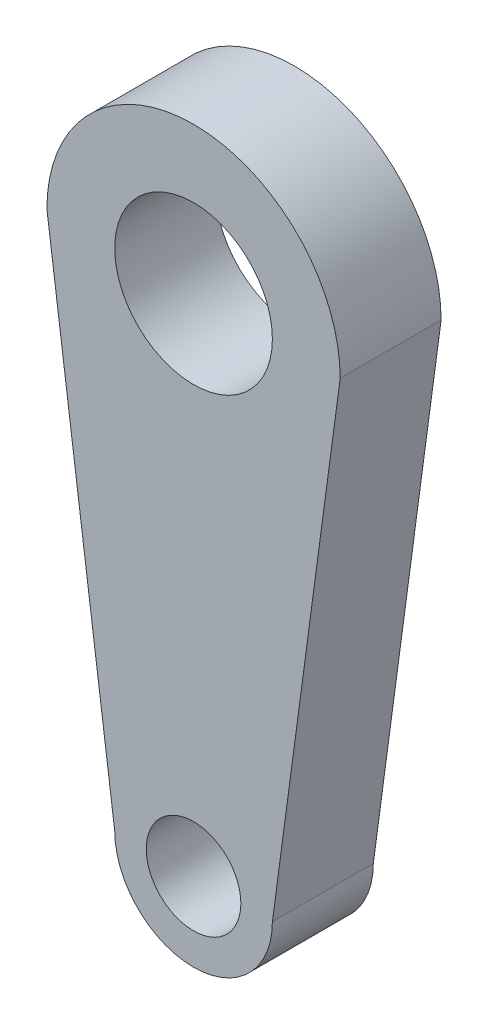
from build123d import *

# Parameters (mm, degrees)
CROQUIS1_R              = 2.5
CROQUIS1_R_2            = 1.5
SALIENTE_EXTRUIR1_DEPTH = 3.2


with BuildPart() as part:
    # Croquis1 → Saliente-Extruir1 (new body)
    with BuildSketch(Plane.XY):
        with BuildLine():
            Line((-4.65, 5.425), (-2.5, -10.575))
            ThreePointArc((-2.5, -10.575), (0, -13.075), (2.5, -10.575))
            Line((2.5, -10.575), (4.65, 5.425))
            ThreePointArc((4.65, 5.425), (0, 10.075), (-4.65, 5.425))
        make_face()
        with Locations((0, 5.425)):
            Circle(CROQUIS1_R, mode=Mode.SUBTRACT)
        with Locations((0, -10.575)):
            Circle(CROQUIS1_R_2, mode=Mode.SUBTRACT)
    extrude(amount=SALIENTE_EXTRUIR1_DEPTH)


solid = part.part
